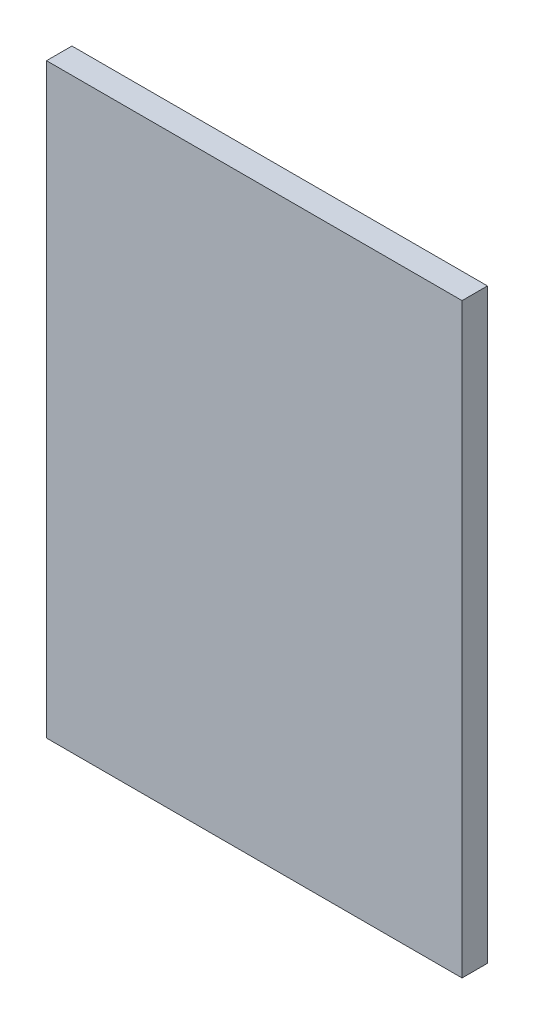
from build123d import *

# Parameters (mm, degrees)
SKETCH1_W           = 53.975
SKETCH1_H           = 76.2
BOSS_EXTRUDE1_DEPTH = 3.302


with BuildPart() as part:
    # Sketch1 → Boss-Extrude1 (new body)
    with BuildSketch(Plane.XY):
        Rectangle(SKETCH1_W, SKETCH1_H)
    extrude(amount=BOSS_EXTRUDE1_DEPTH)


solid = part.part
